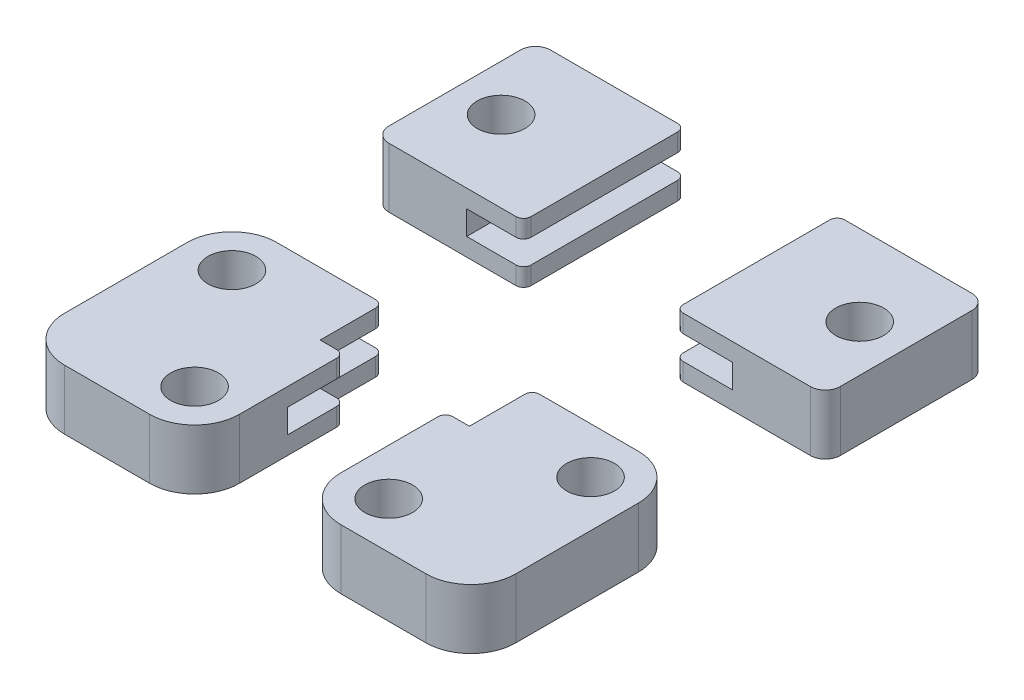
from build123d import *

# Parameters (mm, degrees)
SKETCH1_R           = 1
BOSS_EXTRUDE1_DEPTH = 4
CUT_EXTRUDE1_START  = -1.2
CUT_EXTRUDE1_DEPTH  = 1.6
SKETCH3_R           = 1.6
CUT_EXTRUDE2_DEPTH  = 11.883014288
FILLET1_R           = 3
FILLET2_R           = 0.5
SKETCH5_R           = 1
BOSS_EXTRUDE2_DEPTH = 4
SKETCH7_R           = 1.6
CUT_EXTRUDE4_DEPTH  = 30.246025371
CUT_EXTRUDE5_START  = -1.2
SKETCH8_W           = 3.8
SKETCH8_H           = 10.8
CUT_EXTRUDE5_DEPTH  = 1.6
FILLET3_R           = 0.5
FILLET4_R           = 1
CUT_EXTRUDE3_DEPTH  = 0.3


with BuildPart() as part:
    # Sketch1 → Boss-Extrude1 (new body)
    with BuildSketch(Plane(origin=(0, 0, 0), x_dir=(1, 0, 0), z_dir=(0, 1, 0))):
        Polygon((5.5, 0), (5.5, 3.8), (3.9, 3.8), (3.9, 8), (0, 8), (-6.2, 8), (-6.2, -6.2), (5.5, -6.2), align=None)
        with Locations(Location((-3.1, 4.9, 0), (0, 0, 270))):
            Circle(SKETCH1_R, mode=Mode.SUBTRACT)
        with Locations(Location((2.4, -3.1, 0), (0, 0, 270))):
            Circle(SKETCH1_R, mode=Mode.SUBTRACT)
    extrude(amount=BOSS_EXTRUDE1_DEPTH)

    # Sketch2 → Cut-Extrude1 (cut)
    with BuildSketch(Plane.XZ.offset(CUT_EXTRUDE1_START)):
        Polygon((0, 0), (5.5, 0), (5.5, -3.8), (3.9, -3.8), (3.9, -8), (0, -8), align=None)
    extrude(amount=-CUT_EXTRUDE1_DEPTH, mode=Mode.SUBTRACT)

    # Sketch3 → Cut-Extrude2 (cut, through all)
    with BuildSketch(Plane(origin=(0, 4, 0), x_dir=(1, 0, 0), z_dir=(0, 1, 0))):
        with Locations(Location((2.4, -3.1, 0), (0, 0, 270))):
            Circle(SKETCH3_R)
        with Locations(Location((-3.1, 4.9, 0), (0, 0, 270))):
            Circle(SKETCH3_R)
    extrude(amount=-CUT_EXTRUDE2_DEPTH, mode=Mode.SUBTRACT)

    # Fillet1
    fillet1_edges = [part.edges().sort_by_distance(p)[0] for p in [
        (5.5, 2, 6.2),
        (-6.2, 2, 6.2),
        (-6.2, 2, -8),
    ]]
    fillet(fillet1_edges, radius=FILLET1_R)

    # Fillet2
    fillet2_edges = [part.edges().sort_by_distance(p)[0] for p in [
        (3.9, 3.4, -8),
        (5.5, 3.4, -3.8),
        (3.9, 0.6, -8),
        (5.5, 0.6, -3.8),
    ]]
    fillet(fillet2_edges, radius=FILLET2_R)


with BuildPart() as body_2:
    # Sketch5 → Boss-Extrude2 (new body)
    with BuildSketch(Plane(origin=(0, 0, 0), x_dir=(1, 0, 0), z_dir=(0, 1, 0))):
        Polygon((0, 28.3), (3.8, 28.3), (3.8, 17.5), (0, 17.5), (-6.2, 17.5), (-6.2, 28.3), align=None)
        with Locations(Location((-3.1, 22.9, 0), (0, 0, 90))):
            Circle(SKETCH5_R, mode=Mode.SUBTRACT)
    extrude(amount=BOSS_EXTRUDE2_DEPTH)

    # Sketch7 → Cut-Extrude4 (cut, through all)
    with BuildSketch(Plane(origin=(0, 4, 0), x_dir=(1, 0, 0), z_dir=(0, 1, 0))):
        with Locations(Location((-3.1, 22.9, 0), (0, 0, 270))):
            Circle(SKETCH7_R)
    extrude(amount=-CUT_EXTRUDE4_DEPTH, mode=Mode.SUBTRACT)

    # Sketch8 → Cut-Extrude5 (cut)
    with BuildSketch(Plane.XZ.offset(CUT_EXTRUDE5_START)):
        with Locations((1.9, -22.9)):
            Rectangle(SKETCH8_W, SKETCH8_H)
    extrude(amount=-CUT_EXTRUDE5_DEPTH, mode=Mode.SUBTRACT)

    # Fillet3
    fillet3_edges = [body_2.edges().sort_by_distance(p)[0] for p in [
        (3.8, 3.4, -28.3),
        (3.8, 3.4, -17.5),
        (3.8, 0.6, -17.5),
        (3.8, 0.6, -28.3),
    ]]
    fillet(fillet3_edges, radius=FILLET3_R)

    # Fillet4
    fillet4_edges = [body_2.edges().sort_by_distance(p)[0] for p in [
        (-6.2, 2, -28.3),
        (-6.2, 2, -17.5),
    ]]
    fillet(fillet4_edges, radius=FILLET4_R)


with BuildPart() as body_3:
    # Mirror2: mirrored copy
    add(part.part.mirror(Plane(origin=(8.89, 0, 0), x_dir=(0, 0, 1), z_dir=(1, 0, 0))))

    # Sketch4 → Cut-Extrude3 (cut)
    with BuildSketch(Plane.XZ.offset(-2.8)):
        with BuildLine():
            Line((13.88, -3.8), (13.88, -2.6))
            Line((13.88, -2.6), (12.28, -2.6))
            Line((12.28, -2.6), (12.28, -3.3))
            ThreePointArc((12.28, -3.3), (12.426446609, -3.653553391), (12.78, -3.8))
            Line((12.78, -3.8), (13.88, -3.8))
        make_face()
    extrude(amount=-CUT_EXTRUDE3_DEPTH, mode=Mode.SUBTRACT)


with BuildPart() as body_4:
    # Mirror2 2: mirrored copy
    add(body_2.part.mirror(Plane(origin=(8.89, 0, 0), x_dir=(0, 0, 1), z_dir=(1, 0, 0))))


solid = Compound([part.part, body_2.part, body_3.part, body_4.part])
